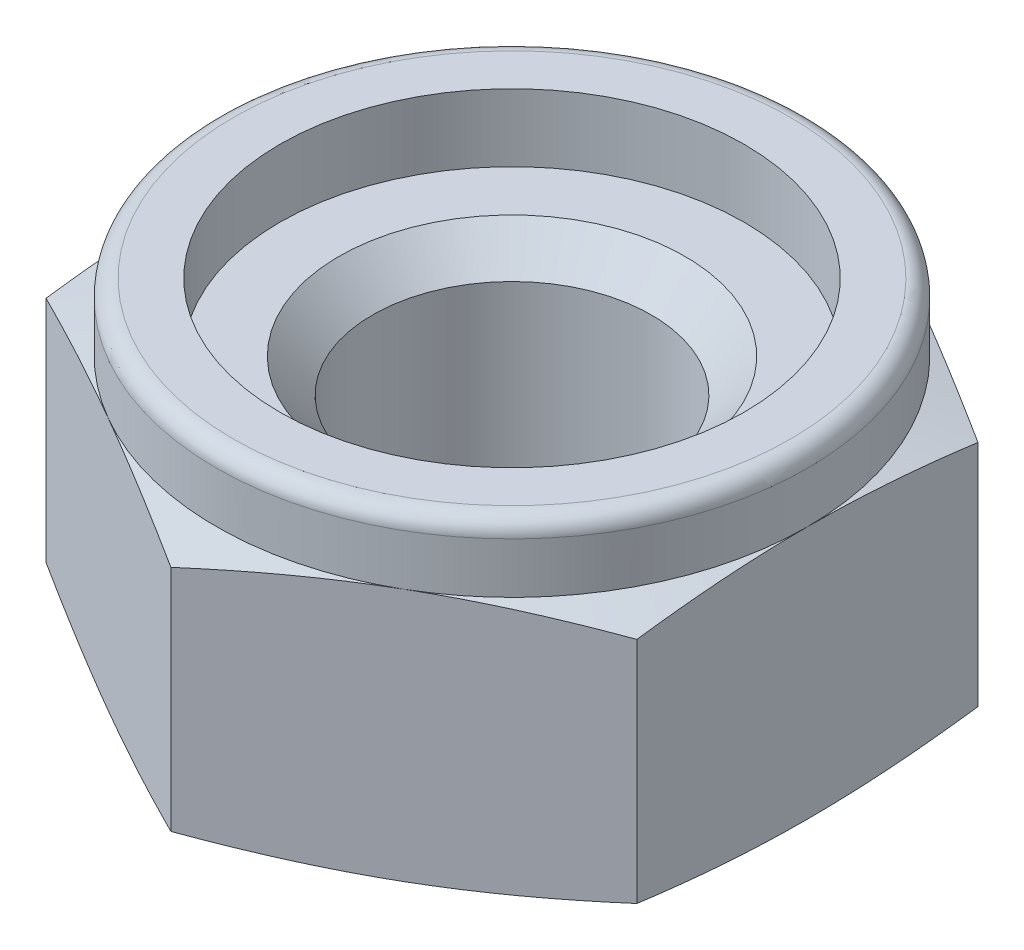
from build123d import *

# Parameters (mm, degrees)
BOSS_EXTRUDE1_DEPTH = 3
TAPPED_HOLE1_D      = 3.3
CHAMFER1_SIZE       = 0.4
SKETCH5_W           = 0.75
SKETCH5_H           = 0.8
FILLET1_R           = 0.2


with BuildPart() as part:
    # Sketch1 → Boss-Extrude1 (new body)
    with BuildSketch(Plane(origin=(0, 0, 0), x_dir=(1, 0, 0), z_dir=(0, 1, 0))):
        Polygon((0, 4.041451884), (-3.5, 2.020725942), (-3.5, -2.020725942), (0, -4.041451884), (3.5, -2.020725942), (3.5, 2.020725942), align=None)
    extrude(amount=-BOSS_EXTRUDE1_DEPTH)

    # Sketch2 → Cut-Revolve1 (revolve, cut)
    with BuildSketch(Plane(origin=(0, 0, 0), x_dir=(0, 0, -1), z_dir=(1, 0, 0))):
        Polygon((3.5, 0), (4.041451884, 0), (4.041451884, -0.145081595), align=None)
        Polygon((4.041451884, -2.854918405), (3.5, -3), (4.041451884, -3), align=None)
    revolve(axis=Axis((0, 0, 0), (0, -1, 0)), mode=Mode.SUBTRACT)

    # Tapped Hole1 (through all)
    with Locations(Plane(origin=(0, 0, 0), x_dir=(1, 0, 0), z_dir=(0, 1, 0))):
        with Locations((0, 0)):
            Hole(TAPPED_HOLE1_D / 2)

    # Chamfer1
    chamfer1_edges = [part.edges().sort_by_distance(p)[0] for p in [
        (1.65, 0, 0),
        (1.65, -3, 0),
    ]]
    chamfer(chamfer1_edges, length=CHAMFER1_SIZE)

    # Sketch5 → Revolve1 (revolve)
    with BuildSketch(Plane.XY, mode=Mode.PRIVATE) as revolve1_sk:
        with Locations((3.125, 0.4)):
            Rectangle(SKETCH5_W, SKETCH5_H)
    revolve(revolve1_sk.sketch.rotate(Axis((0, 0, 0), (0, 1, 0)), 270), axis=Axis((0, 0, 0), (0, 1, 0)))

    # Fillet1
    fillet1_edges = [part.edges().sort_by_distance(p)[0] for p in [
        (0, 0.8, -3.5),
    ]]
    fillet(fillet1_edges, radius=FILLET1_R)


solid = part.part
